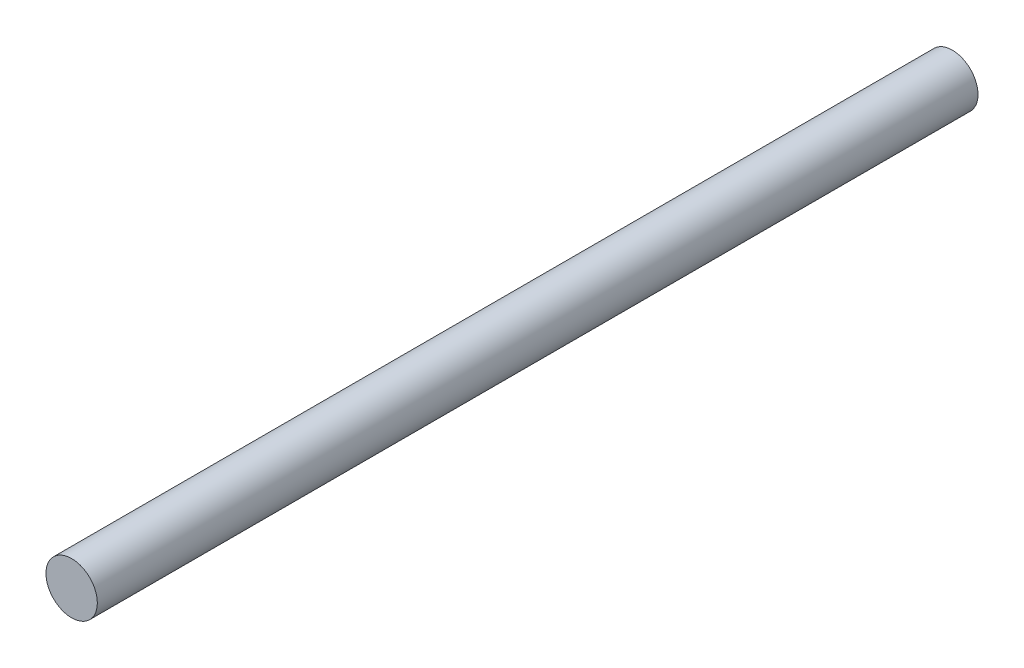
from build123d import *

# Parameters (mm, degrees)
SKETCH1_R           = 3.5
BOSS_EXTRUDE1_DEPTH = 120


with BuildPart() as part:
    # Sketch1 → Boss-Extrude1 (new body)
    with BuildSketch(Plane.XY):
        Circle(SKETCH1_R)
    extrude(amount=BOSS_EXTRUDE1_DEPTH)


solid = part.part
